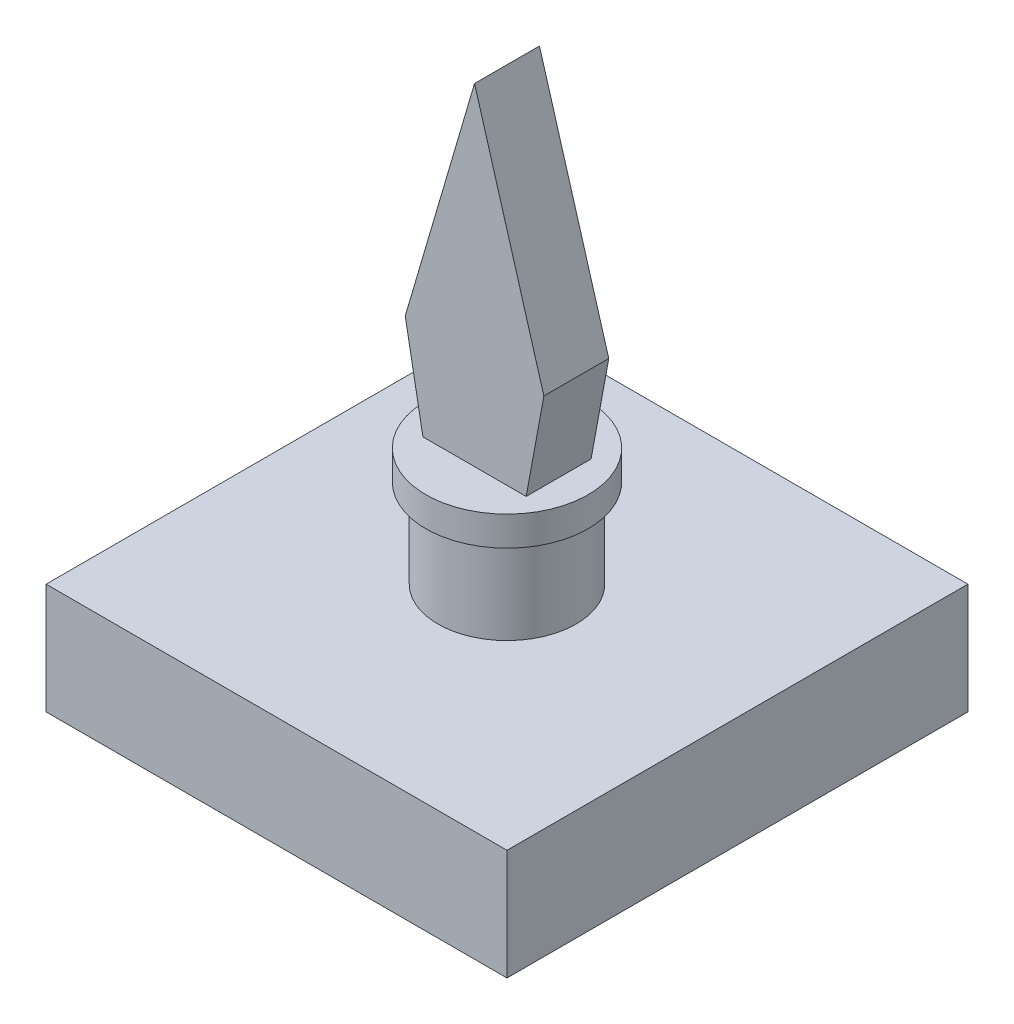
from build123d import *

# Parameters (mm, degrees)
SKETCH2_W           = 12.5
SKETCH2_H           = 12.5
BOSS_EXTRUDE1_DEPTH = 3
BOSS_EXTRUDE2_DEPTH = 0.88


with BuildPart() as part:
    # Sketch2 → Boss-Extrude1 (new body)
    with BuildSketch(Plane(origin=(0, 0, 0), x_dir=(1, 0, 0), z_dir=(0, 1, 0))):
        Rectangle(SKETCH2_W, SKETCH2_H)
    extrude(amount=-BOSS_EXTRUDE1_DEPTH)

    # Sketch3 → Revolve1 (revolve)
    with BuildSketch(Plane.XY, mode=Mode.PRIVATE) as revolve1_sk:
        Polygon((0, 3.2), (2.2, 3.2), (2.2, 2.4), (1.875, 2.4), (1.875, 0), (0, 0), align=None)
    revolve(revolve1_sk.sketch.rotate(Axis((0, -3, 0), (0, 1, 0)), 90), axis=Axis((0, -3, 0), (0, 1, 0)))

    # Sketch4 → Boss-Extrude2 (add, symmetric)
    with BuildSketch(Plane.XY):
        Polygon((0, 12.2), (1.88, 5.8), (1.4, 3.2), (-1.4, 3.2), (-1.88, 5.8), align=None)
    extrude(amount=BOSS_EXTRUDE2_DEPTH, both=True)


solid = part.part
